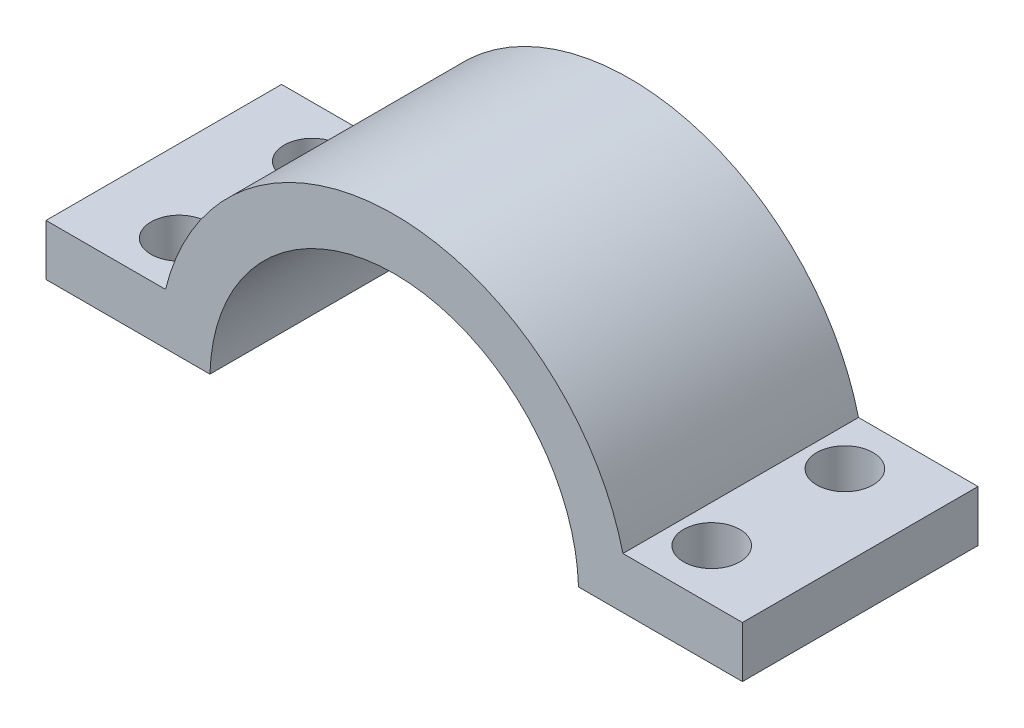
from build123d import *

# Parameters (mm, degrees)
BOSS_EXTRUDE1_DEPTH = 23
SKETCH2_R           = 2.75
CUT_EXTRUDE1_DEPTH  = 47.810789355


with BuildPart() as part:
    # Sketch1 → Boss-Extrude1 (new body)
    with BuildSketch(Plane.XY):
        with BuildLine():
            Line((-17.993054215, 0.5), (-34, 0.5))
            Line((-34, 0.5), (-34, 5.5))
            Line((-34, 5.5), (-22.332711434, 5.5))
            ThreePointArc((-22.332711434, 5.5), (0, 23), (22.332711434, 5.5))
            Line((22.332711434, 5.5), (34, 5.5))
            Line((34, 5.5), (34, 0.5))
            Line((34, 0.5), (17.993054215, 0.5))
            ThreePointArc((17.993054215, 0.5), (0, 18), (-17.993054215, 0.5))
        make_face()
    extrude(amount=BOSS_EXTRUDE1_DEPTH)

    # Sketch2 → Cut-Extrude1 (cut, through all)
    with BuildSketch(Plane.XZ.offset(-0.5)):
        with Locations((-26, 18)):
            Circle(SKETCH2_R)
        with Locations((-26, 5)):
            Circle(SKETCH2_R)
        with Locations((26, 5)):
            Circle(SKETCH2_R)
        with Locations((26, 18)):
            Circle(SKETCH2_R)
    extrude(amount=-CUT_EXTRUDE1_DEPTH, mode=Mode.SUBTRACT)


solid = part.part
